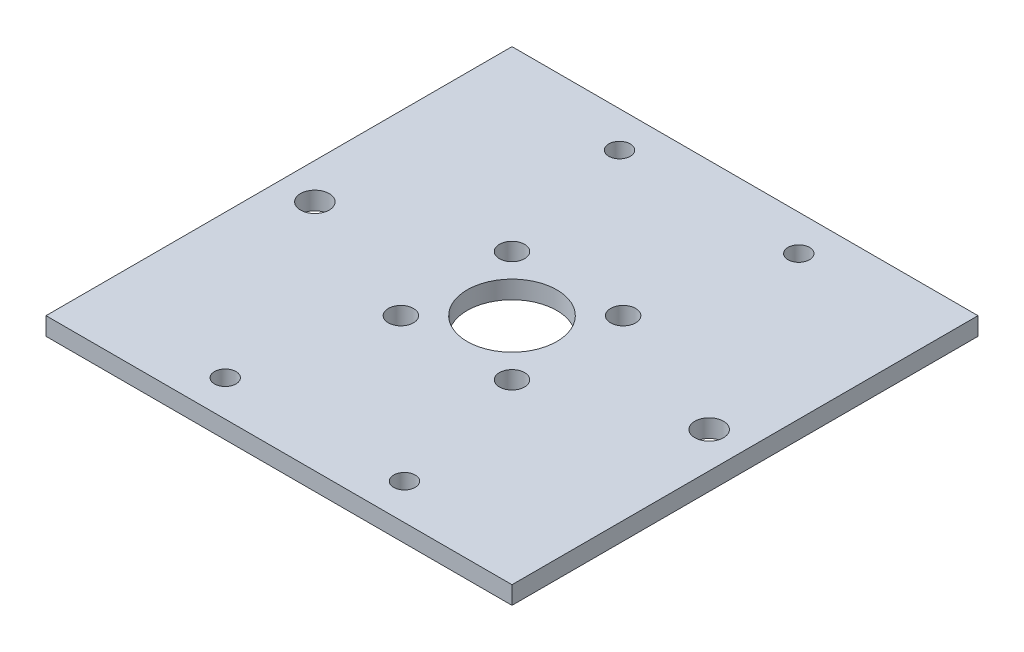
from build123d import *

# Parameters (mm, degrees)
SKETCH1_W           = 130
SKETCH1_H           = 130
SKETCH1_R           = 12.5
SKETCH1_R_2         = 4
BOSS_EXTRUDE1_DEPTH = 5
SKETCH2_R           = 3
CUT_EXTRUDE1_DEPTH  = 10
SKETCH3_R           = 3.5
CUT_EXTRUDE2_DEPTH  = 5


with BuildPart() as part:
    # Sketch1 → Boss-Extrude1 (new body)
    with BuildSketch(Plane(origin=(0, 0, 0), x_dir=(1, 0, 0), z_dir=(0, 1, 0))):
        Rectangle(SKETCH1_W, SKETCH1_H)
        with Locations(Location((0, 0, 0), (0, 0, 270))):
            Circle(SKETCH1_R, mode=Mode.SUBTRACT)
        with Locations(Location((-55, 0, 0), (0, 0, 270))):
            Circle(SKETCH1_R_2, mode=Mode.SUBTRACT)
        with Locations(Location((55, 0, 0), (0, 0, 270))):
            Circle(SKETCH1_R_2, mode=Mode.SUBTRACT)
    extrude(amount=BOSS_EXTRUDE1_DEPTH)

    # Sketch2 → Cut-Extrude1 (cut)
    with BuildSketch(Plane(origin=(0, 5, 0), x_dir=(1, 0, 0), z_dir=(0, 1, 0))):
        with Locations(Location((-25, 55, 0), (0, 0, 270))):
            Circle(SKETCH2_R)
        with Locations(Location((25, 55, 0), (0, 0, 270))):
            Circle(SKETCH2_R)
        with Locations(Location((25, -55, 0), (0, 0, 270))):
            Circle(SKETCH2_R)
        with Locations(Location((-25, -55, 0), (0, 0, 270))):
            Circle(SKETCH2_R)
    extrude(amount=-CUT_EXTRUDE1_DEPTH, mode=Mode.SUBTRACT)

    # Sketch3 → Cut-Extrude2 (cut)
    with BuildSketch(Plane(origin=(0, 5, 0), x_dir=(1, 0, 0), z_dir=(0, 1, 0))):
        with Locations(Location((-15.5, 15.5, 0), (0, 0, 270))):
            Circle(SKETCH3_R)
        with Locations(Location((15.5, 15.5, 0), (0, 0, 270))):
            Circle(SKETCH3_R)
        with Locations(Location((-15.5, -15.5, 0), (0, 0, 270))):
            Circle(SKETCH3_R)
        with Locations(Location((15.5, -15.5, 0), (0, 0, 270))):
            Circle(SKETCH3_R)
    extrude(amount=-CUT_EXTRUDE2_DEPTH, mode=Mode.SUBTRACT)


solid = part.part
